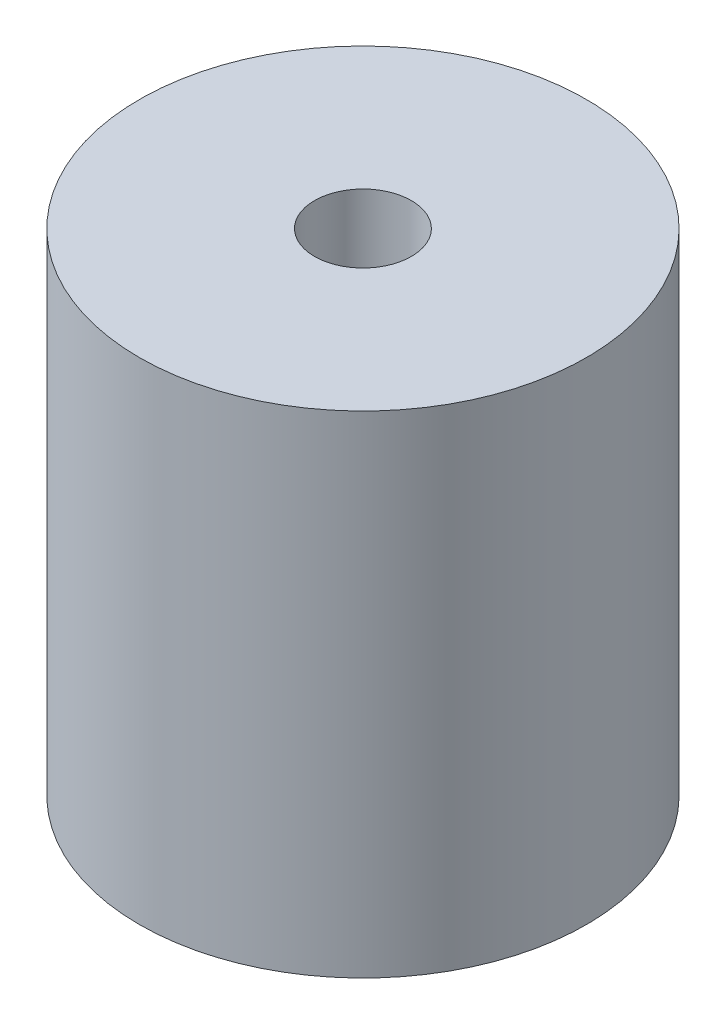
from build123d import *

# Parameters (mm, degrees)
ESBO_O1_R                = 30
ESBO_O1_R_2              = 6.5
RESSALTO_EXTRUS_O1_DEPTH = 65.9


with BuildPart() as part:
    # Esboço1 → Ressalto-extrusão1 (new body)
    with BuildSketch(Plane(origin=(0, 0, 0), x_dir=(1, 0, 0), z_dir=(0, 1, 0))):
        with Locations(Location((0, 0, 0), (0, 0, 270))):
            Circle(ESBO_O1_R)
        with Locations(Location((0, 0, 0), (0, 0, 270))):
            Circle(ESBO_O1_R_2, mode=Mode.SUBTRACT)
    extrude(amount=RESSALTO_EXTRUS_O1_DEPTH)


solid = part.part
